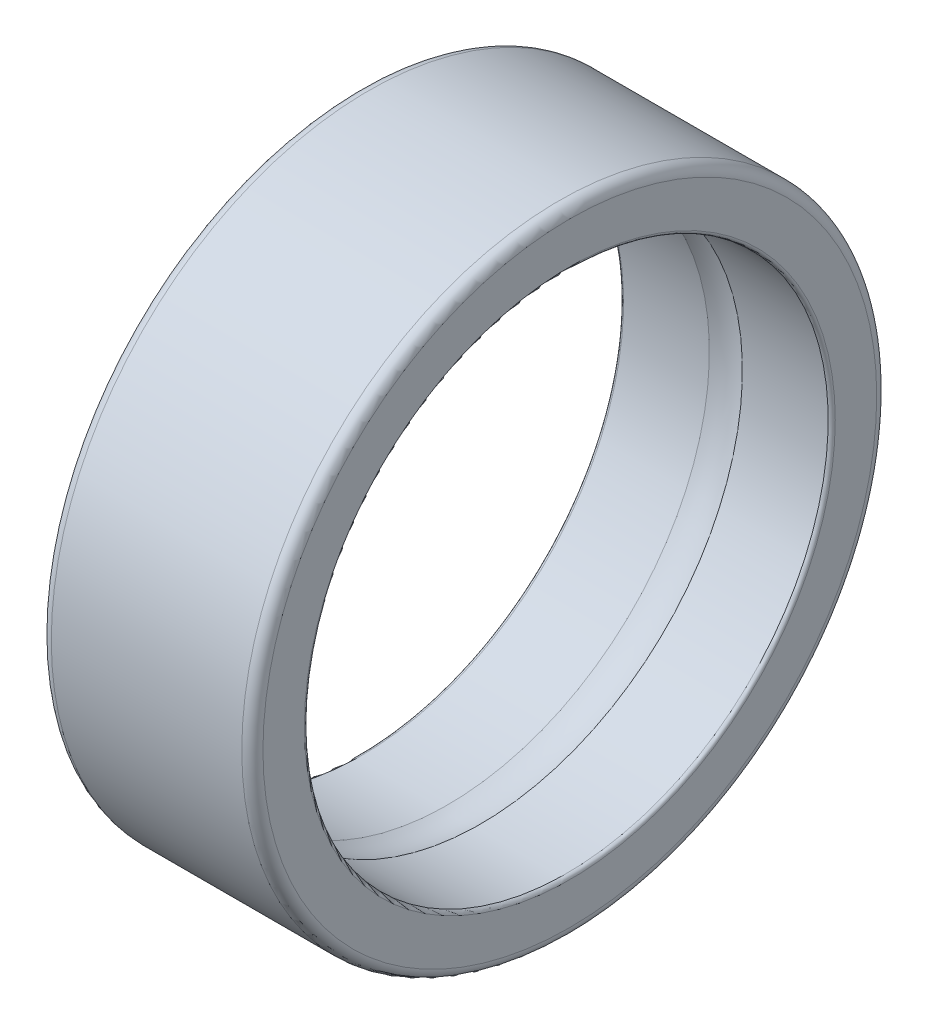
from build123d import *


with BuildPart() as part:
    # Sketch1 → Revolução1 (revolve)
    with BuildSketch(Plane.XY, mode=Mode.PRIVATE) as revolu_o1_sk:
        with BuildLine():
            Line((0.066666667, 4.95), (1.6877501, 4.95))
            ThreePointArc((1.6877501, 4.95), (2, 5), (2.3122499, 4.95))
            Line((2.3122499, 4.95), (3.933333333, 4.95))
            ThreePointArc((3.933333333, 4.95), (3.980473785, 4.969526215), (4, 5.016666667))
            Line((4, 5.016666667), (4, 5.8))
            ThreePointArc((4, 5.8), (3.941421356, 5.941421356), (3.8, 6))
            Line((3.8, 6), (0.2, 6))
            ThreePointArc((0.2, 6), (0.058578644, 5.941421356), (0, 5.8))
            Line((0, 5.8), (0, 5.016666667))
            ThreePointArc((0, 5.016666667), (0.019526215, 4.969526215), (0.066666667, 4.95))
        make_face()
    revolve(revolu_o1_sk.sketch.rotate(Axis((4, 0, 0), (-1, 0, 0)), 270), axis=Axis((4, 0, 0), (-1, 0, 0)))


solid = part.part
